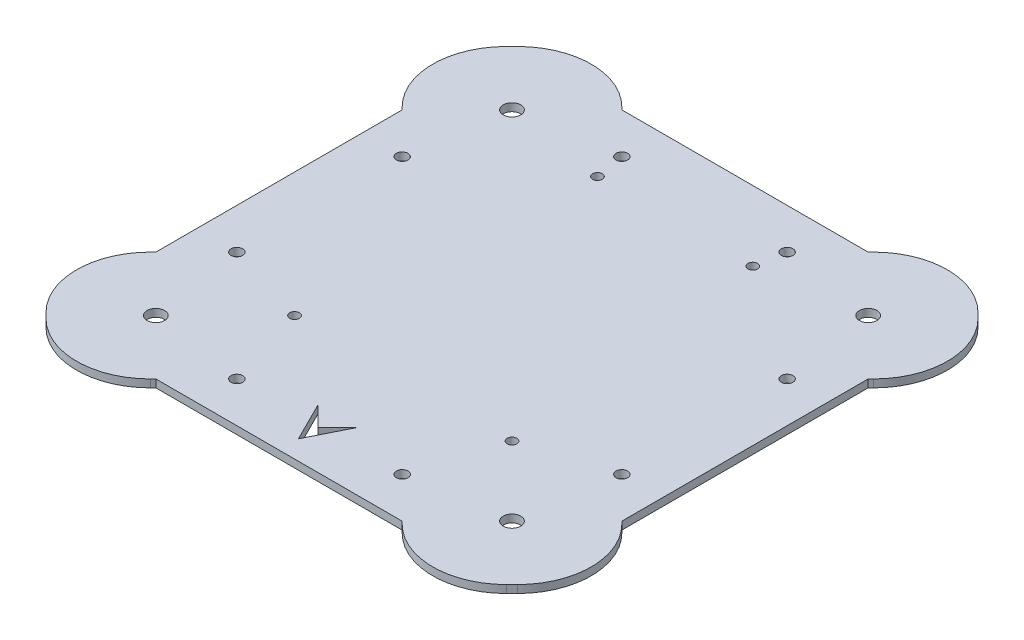
from build123d import *

# Parameters (mm, degrees)
SKETCH1_W           = 120
SKETCH1_H           = 120
BOSS_EXTRUDE1_DEPTH = 2
BOSS_EXTRUDE3_DEPTH = 2
FILLET1_R           = 19
SKETCH4_R           = 1.5
CUT_EXTRUDE2_DEPTH  = 2
SKETCH5_R           = 2.25
CUT_EXTRUDE3_DEPTH  = 10
SKETCH6_R           = 1.25
CUT_EXTRUDE4_DEPTH  = 15
CUT_EXTRUDE5_DEPTH  = 2


with BuildPart() as part:
    # Sketch1 → Boss-Extrude1 (new body)
    with BuildSketch(Plane(origin=(0, 0, 0), x_dir=(1, 0, 0), z_dir=(0, 1, 0))):
        with Locations((60, 60)):
            Rectangle(SKETCH1_W, SKETCH1_H)
    extrude(amount=BOSS_EXTRUDE1_DEPTH)

    # Sketch2 → Boss-Extrude3 (add)
    with BuildSketch(Plane(origin=(0, 2, 0), x_dir=(1, 0, 0), z_dir=(0, 1, 0))):
        Polygon((91.715727302, 120), (120, 91.715730203), (134.142134899, 105.857866552), (105.857862201, 134.142136349), align=None)
        Polygon((0, 91.715730203), (-14.142134899, 105.857866552), (14.142137799, 134.142136349), (28.284272698, 120), align=None)
        Polygon((28.284272698, 0), (0, 28.284269797), (-14.142134899, 14.142133448), (14.142137799, -14.142136349), align=None)
        Polygon((120, 28.284269797), (134.142134899, 14.142133448), (105.857862201, -14.142136349), (91.715727302, 0), align=None)
    extrude(amount=-BOSS_EXTRUDE3_DEPTH)

    # Fillet1
    fillet1_edges = [part.edges().sort_by_distance(p)[0] for p in [
        (105.857862201, 1, -134.142136349),
        (134.142134899, 1, -105.857866552),
        (-14.142134899, 1, -105.857866552),
        (14.142137799, 1, -134.142136349),
        (14.142137799, 1, 14.142136349),
        (-14.142134899, 1, -14.142133448),
        (134.142134899, 1, -14.142133448),
        (105.857862201, 1, 14.142136349),
    ]]
    fillet(fillet1_edges, radius=FILLET1_R)

    # Sketch4 → Cut-Extrude2 (cut)
    with BuildSketch(Plane(origin=(0, 2, 0), x_dir=(1, 0, 0), z_dir=(0, 1, 0))):
        with Locations(Location((38.717632184, 10.433360556, 0), (0, 0, 270))):
            Circle(SKETCH4_R)
        with Locations(Location((10.433360556, 38.717632184, 0), (0, 0, 90))):
            Circle(SKETCH4_R)
        with Locations(Location((81.282367816, 10.433360556, 0), (0, 0, 90))):
            Circle(SKETCH4_R)
        with Locations(Location((109.566639444, 38.717632184, 0), (0, 0, 270))):
            Circle(SKETCH4_R)
        with Locations(Location((38.717632184, 109.566639444, 0), (0, 0, 90))):
            Circle(SKETCH4_R)
        with Locations(Location((10.433360556, 81.282367816, 0), (0, 0, 270))):
            Circle(SKETCH4_R)
        with Locations(Location((81.282367816, 109.566639444, 0), (0, 0, 270))):
            Circle(SKETCH4_R)
        with Locations(Location((109.566639444, 81.282367816, 0), (0, 0, 90))):
            Circle(SKETCH4_R)
    extrude(amount=-CUT_EXTRUDE2_DEPTH, mode=Mode.SUBTRACT)

    # Sketch5 → Cut-Extrude3 (cut)
    with BuildSketch(Plane(origin=(0, 2, 0), x_dir=(1, 0, 0), z_dir=(0, 1, 0))):
        with Locations(Location((14.142136349, 14.142134899, 0), (0, 0, 270))):
            Circle(SKETCH5_R)
        with Locations(Location((105.857863651, 14.142134899, 0), (0, 0, 90))):
            Circle(SKETCH5_R)
        with Locations(Location((14.142136349, 105.857865101, 0), (0, 0, 90))):
            Circle(SKETCH5_R)
        with Locations(Location((105.857863651, 105.857865101, 0), (0, 0, 270))):
            Circle(SKETCH5_R)
    extrude(amount=-CUT_EXTRUDE3_DEPTH, mode=Mode.SUBTRACT)

    # Sketch6 → Cut-Extrude4 (cut)
    with BuildSketch(Plane(origin=(0, 2, 0), x_dir=(1, 0, 0), z_dir=(0, 1, 0))):
        with Locations(Location((80, 101.999971357, 0), (0, 0, 270))):
            Circle(SKETCH6_R)
        with Locations(Location((88, 31.999971357, 0), (0, 0, 270))):
            Circle(SKETCH6_R)
        with Locations(Location((32, 31.999971357, 0), (0, 0, 90))):
            Circle(SKETCH6_R)
        with Locations(Location((40, 101.999971357, 0), (0, 0, 90))):
            Circle(SKETCH6_R)
    extrude(amount=-CUT_EXTRUDE4_DEPTH, mode=Mode.SUBTRACT)

    # Sketch7 → Cut-Extrude5 (cut)
    with BuildSketch(Plane(origin=(0, 2, 0), x_dir=(1, 0, 0), z_dir=(0, 1, 0))):
        Polygon((65, 15), (60, 5), (55, 15), (60, 10), align=None)
    extrude(amount=-CUT_EXTRUDE5_DEPTH, mode=Mode.SUBTRACT)


solid = part.part
